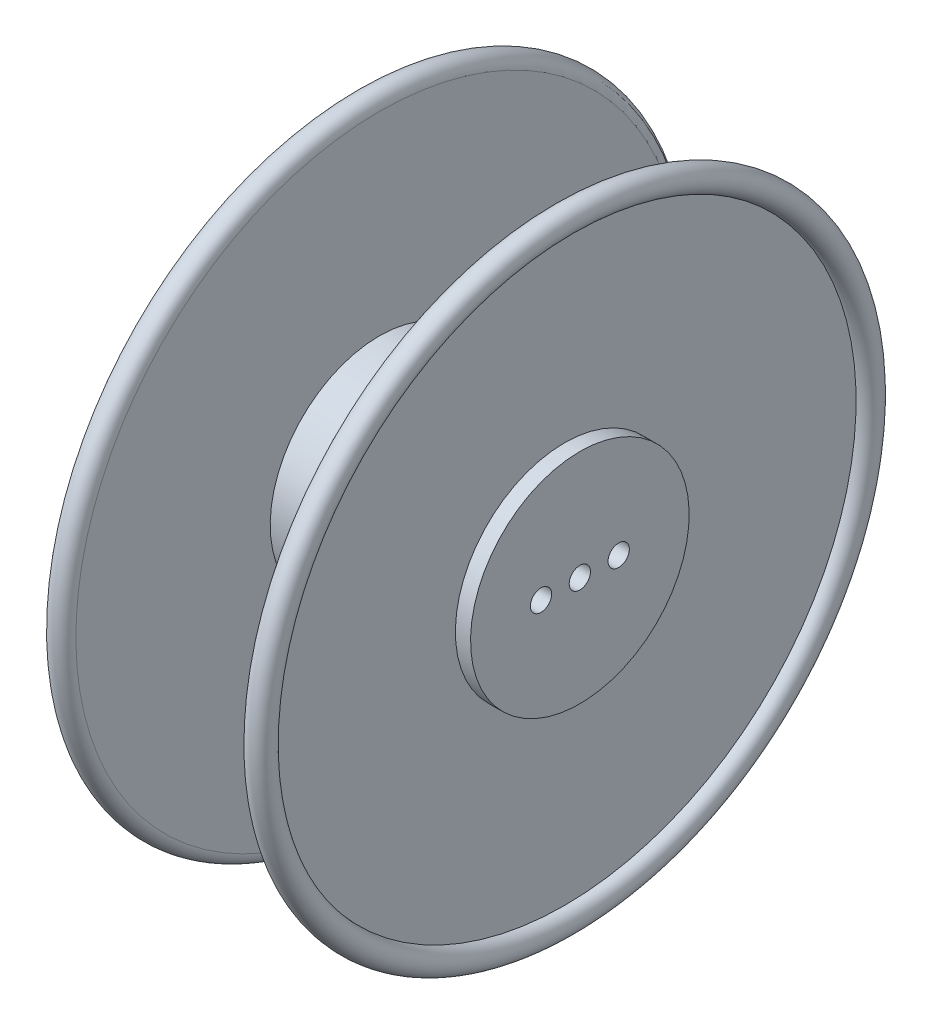
from build123d import *

# Parameters (mm, degrees)
ESQUISSE2_R             = 17.5
ENL_V_MAT_EXTRU_1_DEPTH = 826.484706223
ESQUISSE2_3_R           = 17.5
ENL_V_MAT_EXTRU_2_DEPTH = 50


with BuildPart() as part:
    # Esquisse1 → Révolution1 (revolve)
    with BuildSketch(Plane.XY):
        with BuildLine():
            Line((45, 0), (45, 180))
            Line((45, 180), (20, 180))
            Line((20, 180), (20, 480))
            ThreePointArc((20, 480), (34.142135624, 514.142135624), (0, 500))
            Line((0, 500), (0, 180))
            Line((0, 180), (-285, 180))
            Line((-285, 180), (-285, 500))
            ThreePointArc((-285, 500), (-319.142135624, 514.142135624), (-305, 480))
            Line((-305, 480), (-305, 180))
            Line((-305, 180), (-330, 180))
            Line((-330, 180), (-330, 0))
            Line((-330, 0), (45, 0))
        make_face()
    revolve(axis=Axis((45, 0, 0), (-1, 0, 0)))

    # Esquisse2 → Enlèv. mat.-Extru.1 (cut, through all)
    with BuildSketch(Plane(origin=(45, 0, 0), x_dir=(0, 0, -1), z_dir=(1, 0, 0))):
        Circle(ESQUISSE2_R)
    extrude(amount=-ENL_V_MAT_EXTRU_1_DEPTH, mode=Mode.SUBTRACT)

    # Esquisse2<3> → Enlèv. mat.-Extru.2 (cut)
    with BuildSketch(Plane(origin=(45, 0, 0), x_dir=(0, 0, -1), z_dir=(1, 0, 0))):
        with Locations((64, 0)):
            Circle(ESQUISSE2_3_R)
        with Locations((-64, 0)):
            Circle(ESQUISSE2_3_R)
    extrude(amount=-ENL_V_MAT_EXTRU_2_DEPTH, mode=Mode.SUBTRACT)


solid = part.part
